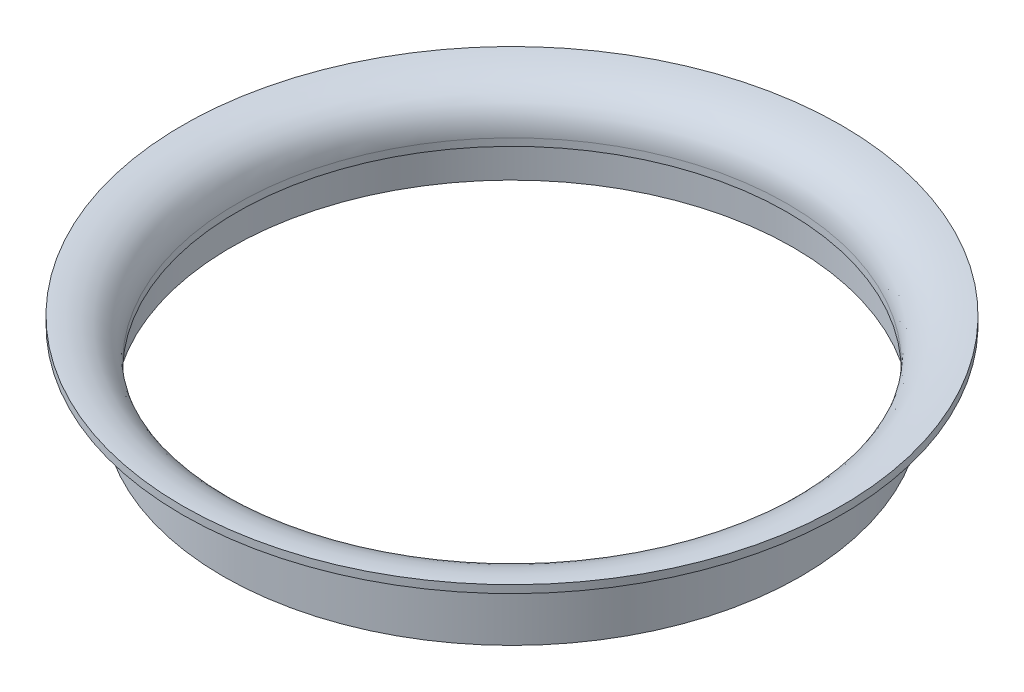
from build123d import *


with BuildPart() as part:
    # Эскиз1 → Повернуть1 (revolve)
    with BuildSketch(Plane.XY, mode=Mode.PRIVATE) as revolve_1_sk:
        with BuildLine():
            add(Edge.make_bspline(
                [(35.5, 5.246277438), (35.5, 8.143447641), (37.308176534, 10.5), (42.5, 10.5)],
                knots=[0, 0, 0, 0, 1, 1, 1, 1], degree=3))
            Line((42.5, 10.5), (42.5, 9.5))
            add(Edge.make_bspline(
                [(37.25, 6), (37.25, 8.103238244), (38.992444762, 9.5), (42.5, 9.5)],
                knots=[0, 0, 0, 0, 1, 1, 1, 1], degree=3))
            Line((37.25, 6), (37.25, 0))
            Line((37.25, 0), (36.25, 0))
            Line((36.25, 0), (36.25, 4.3))
            Line((36.25, 4.3), (35.5, 4.3))
            Line((35.5, 4.3), (35.5, 5.246277438))
        make_face()
    revolve(revolve_1_sk.sketch.rotate(Axis((0, 0, 0), (0, 1, 0)), 90), axis=Axis((0, 0, 0), (0, 1, 0)))


solid = part.part
